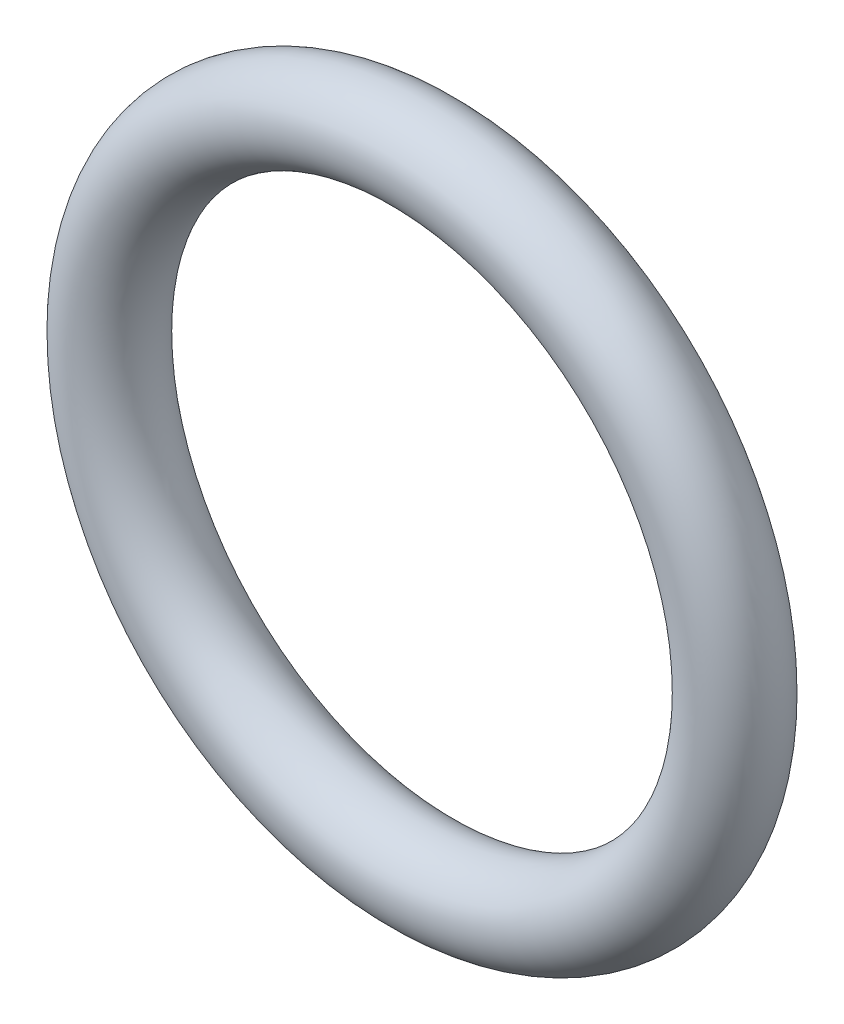
from build123d import *

# Parameters (mm, degrees)
SKETCH1_R = 0.889


with BuildPart() as part:
    # Sketch1 → Revolve1 (revolve)
    with BuildSketch(Plane(origin=(0, 0, 0), x_dir=(0, -1, 0), z_dir=(1, 0, 0)), mode=Mode.PRIVATE) as revolve1_sk:
        with Locations((6.2992, 0)):
            Circle(SKETCH1_R)
    revolve(revolve1_sk.sketch.rotate(Axis((0, 0, 0.889), (0, 0, -1)), 270), axis=Axis((0, 0, 0.889), (0, 0, -1)))


solid = part.part
